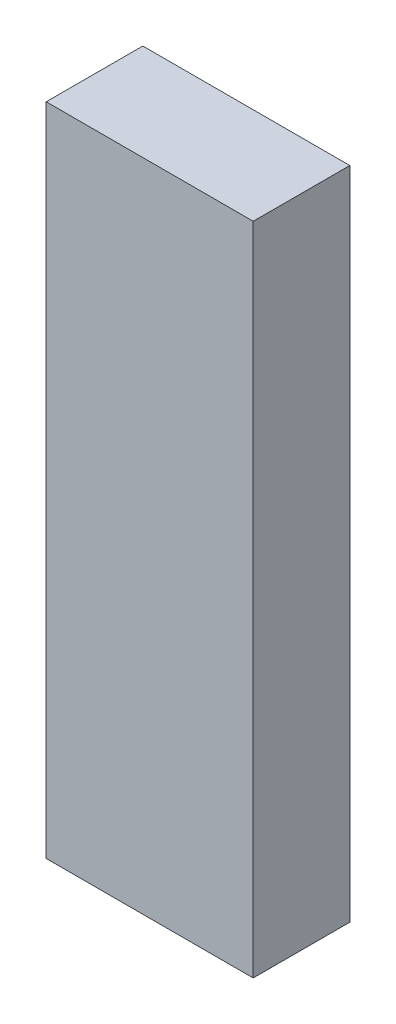
from build123d import *

# Parameters (mm, degrees)
SKETCH1_W           = 375
SKETCH1_H           = 175
BOSS_EXTRUDE1_DEPTH = 1187.25


with BuildPart() as part:
    # Sketch1 → Boss-Extrude1 (new body)
    with BuildSketch(Plane(origin=(0, 0, 0), x_dir=(1, 0, 0), z_dir=(0, 1, 0))):
        Rectangle(SKETCH1_W, SKETCH1_H)
    extrude(amount=BOSS_EXTRUDE1_DEPTH)


solid = part.part
